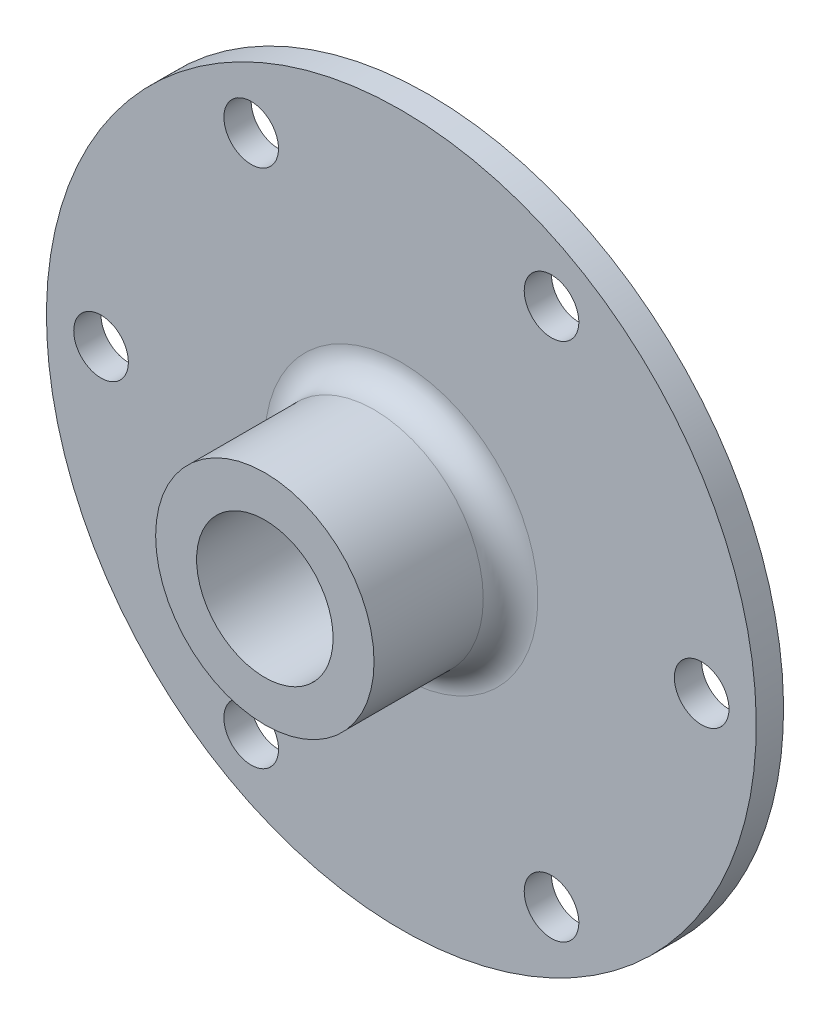
from build123d import *

# Parameters (mm, degrees)
SKETCH2_R            = 7.9375
CENTER_CUT_DEPTH     = 62.401577748
SKETCH3_R            = 3.175
PERIPHERAL_CUT_DEPTH = 61.491874454
CIRPATTERN_COUNT     = 6
FILLET_2_R           = 3.175


with BuildPart() as part:
    # Sketch1 → Revolve 2 (revolve)
    with BuildSketch(Plane(origin=(0, 0, 0), x_dir=(0, 0, -1), z_dir=(1, 0, 0))):
        Polygon((0, 0), (0, 41.275), (-3.175, 41.275), (-3.175, 12.7), (-19.05, 12.7), (-19.05, 0), align=None)
    revolve(axis=Axis((0, 0, 0), (0, 0, 1)))

    # Sketch2 → Center Cut (cut, through all)
    with BuildSketch(Plane.XY.offset(19.05)):
        Circle(SKETCH2_R)
    extrude(amount=-CENTER_CUT_DEPTH, mode=Mode.SUBTRACT)

    # Sketch3 → Peripheral Cut (cut, through all)
    with BuildSketch(Plane.XY.offset(3.175)):
        with Locations((34.925, 0)):
            Circle(SKETCH3_R)
    peripheral_cut = extrude(amount=-PERIPHERAL_CUT_DEPTH, mode=Mode.SUBTRACT)

    # CirPattern: Peripheral Cut ×6 about axis
    cirpattern_axis = Axis((0, 0, 0), (0, 0, 1))
    for i in range(1, CIRPATTERN_COUNT):
        add(peripheral_cut.rotate(cirpattern_axis, i * 360 / CIRPATTERN_COUNT), mode=Mode.SUBTRACT)

    # Fillet 2
    fillet_2_edges = [part.edges().sort_by_distance(p)[0] for p in [
        (0, -12.7, 3.175),
    ]]
    fillet(fillet_2_edges, radius=FILLET_2_R)


solid = part.part
